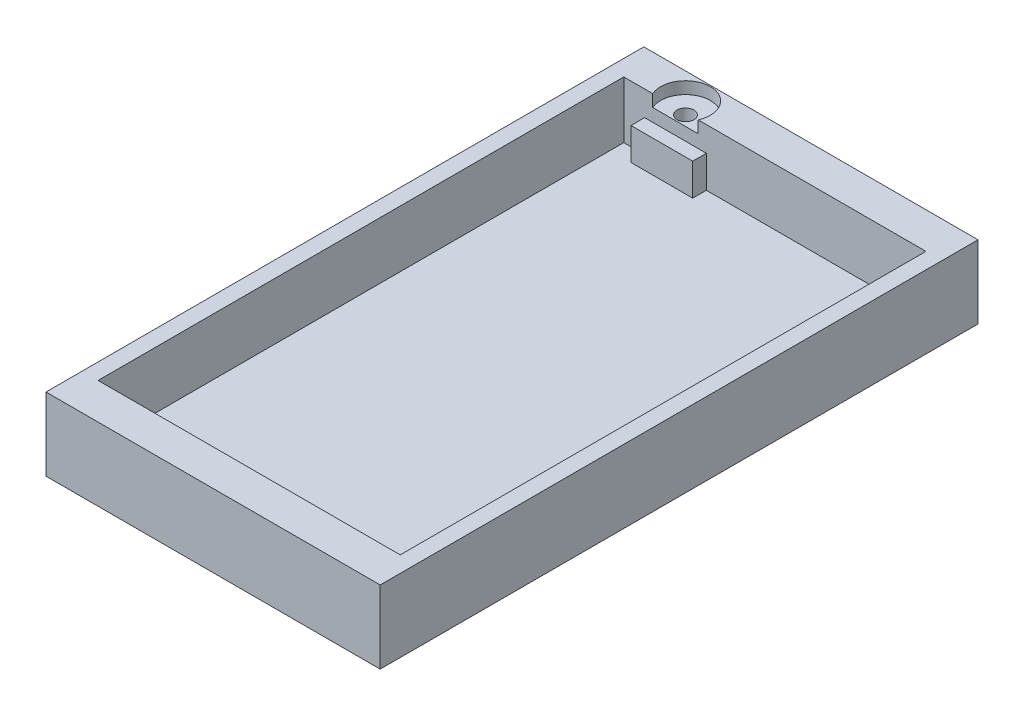
from build123d import *

# Parameters (mm, degrees)
BOSS_EXTRUDE1_DEPTH      = 3.1
BOSS_EXTRUDE1_DEPTH_BACK = 6
SKETCH1_W                = 41.7
SKETCH1_H                = 74.6
CUT_EXTRUDE1_DEPTH       = 44.151042861
CUT_EXTRUDE1_DEPTH_BACK  = 4
SKETCH2_W                = 37.7
SKETCH2_H                = 65.6
CUT_EXTRUDE2_DEPTH       = 1.75
CUT_EXTRUDE2_DEPTH_BACK  = 0.15
SKETCH3_W                = 36.8
SKETCH3_H                = 2
SKETCH4_W                = 7.7
SKETCH4_H                = 1.7
BOSS_EXTRUDE2_DEPTH      = 4
CUT_EXTRUDE3_START       = 1.6
SKETCH5_R                = 3.1
CUT_EXTRUDE3_DEPTH       = 42.551042861
CUT_EXTRUDE4_DEPTH       = 44.151042861
CUT_EXTRUDE4_DEPTH_BACK  = 5
SKETCH6_R                = 1.05


with BuildPart() as part:
    # Sketch1 → Boss-Extrude1 (new, two sides: drawn at the far end of the back side and taken through both)
    with BuildSketch(Plane(origin=(0, 0, 0), x_dir=(1, 0, 0), z_dir=(0, 1, 0)).offset(-BOSS_EXTRUDE1_DEPTH_BACK)):
        Rectangle(SKETCH1_W, SKETCH1_H)
    extrude(amount=BOSS_EXTRUDE1_DEPTH + BOSS_EXTRUDE1_DEPTH_BACK)

    # Sketch2 → Cut-Extrude1 (cut, two sides: drawn at the far end of the back side and taken through both)
    with BuildSketch(Plane(origin=(0, 0, 0), x_dir=(1, 0, 0), z_dir=(0, 1, 0)).offset(-CUT_EXTRUDE1_DEPTH_BACK)):
        Rectangle(SKETCH2_W, SKETCH2_H)
    extrude(amount=CUT_EXTRUDE1_DEPTH + CUT_EXTRUDE1_DEPTH_BACK, mode=Mode.SUBTRACT)

    # Sketch3 → Cut-Extrude2 (cut, two sides: drawn at the far end of the back side and taken through both)
    with BuildSketch(Plane(origin=(0, 0, 0), x_dir=(1, 0, 0), z_dir=(0, 1, 0)).offset(-CUT_EXTRUDE2_DEPTH_BACK)):
        with Locations((0, -33.8)):
            Rectangle(SKETCH3_W, SKETCH3_H)
    extrude(amount=CUT_EXTRUDE2_DEPTH + CUT_EXTRUDE2_DEPTH_BACK, mode=Mode.SUBTRACT)

    # Sketch4 → Boss-Extrude2 (add)
    with BuildSketch(Plane(origin=(0, 0, 0), x_dir=(1, 0, 0), z_dir=(0, 1, 0))):
        with Locations((-12.4, 31.95)):
            Rectangle(SKETCH4_W, SKETCH4_H)
    extrude(amount=-BOSS_EXTRUDE2_DEPTH)

    # Sketch5 → Cut-Extrude3 (cut, through all)
    with BuildSketch(Plane(origin=(0, 0, 0), x_dir=(1, 0, 0), z_dir=(0, 1, 0)).offset(CUT_EXTRUDE3_START)):
        with Locations((-12.4, 34.05)):
            Circle(SKETCH5_R)
    extrude(amount=CUT_EXTRUDE3_DEPTH, mode=Mode.SUBTRACT)

    # Sketch6 → Cut-Extrude4 (cut, two sides: drawn at the far end of the back side and taken through both)
    with BuildSketch(Plane(origin=(0, 0, 0), x_dir=(1, 0, 0), z_dir=(0, 1, 0)).offset(-CUT_EXTRUDE4_DEPTH_BACK)):
        with Locations(Location((-12.4, 34.05, 0), (0, 0, 270))):
            Circle(SKETCH6_R)
    extrude(amount=CUT_EXTRUDE4_DEPTH + CUT_EXTRUDE4_DEPTH_BACK, mode=Mode.SUBTRACT)


solid = part.part
